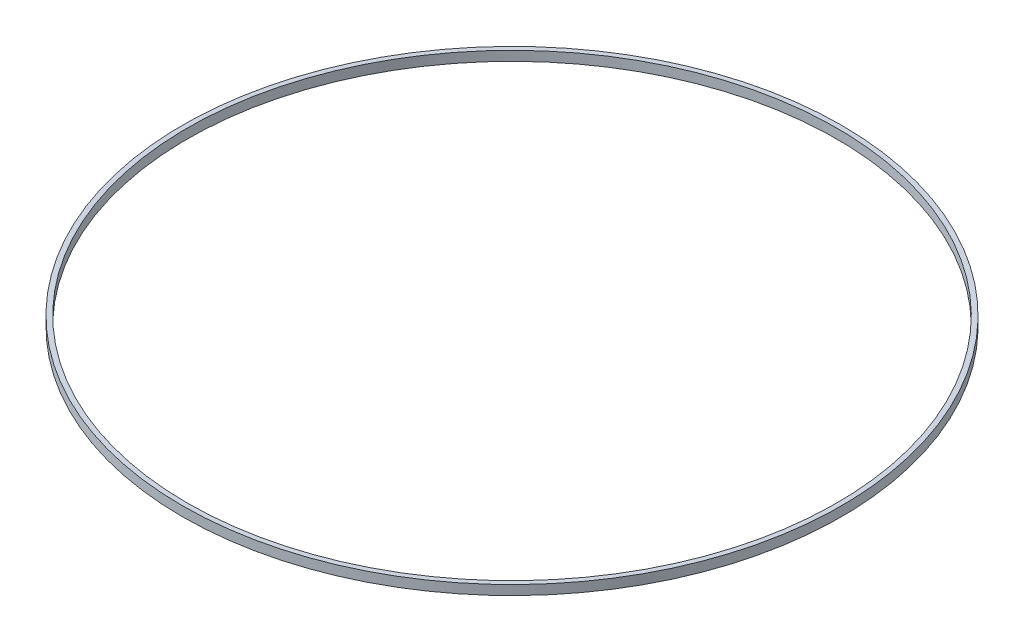
from build123d import *

# Parameters (mm, degrees)
SKETCH1_R           = 345
SKETCH1_R_2         = 340
BOSS_EXTRUDE1_DEPTH = 10


with BuildPart() as part:
    # Sketch1 → Boss-Extrude1 (new body)
    with BuildSketch(Plane(origin=(0, 0, 0), x_dir=(1, 0, 0), z_dir=(0, 1, 0))):
        with Locations(Location((0, 0, 0), (0, 0, 270))):
            Circle(SKETCH1_R)
        with Locations(Location((0, 0, 0), (0, 0, 270))):
            Circle(SKETCH1_R_2, mode=Mode.SUBTRACT)
    extrude(amount=BOSS_EXTRUDE1_DEPTH)


solid = part.part
